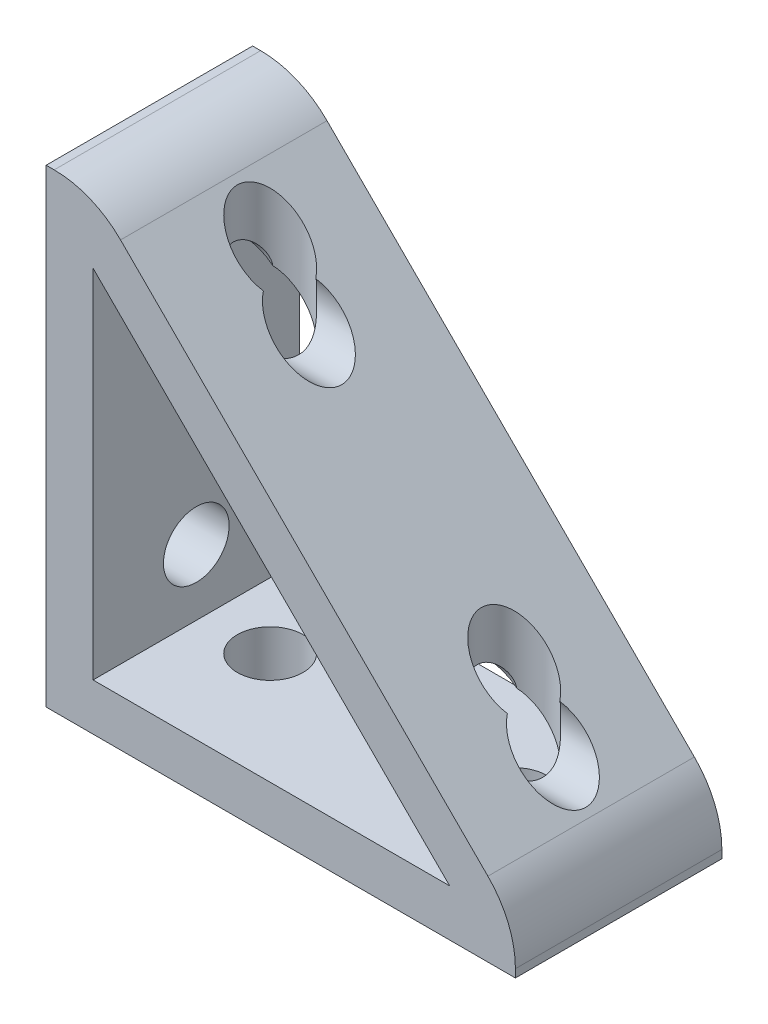
from build123d import *

# Parameters (mm, degrees)
BOSS_EXTRUDE1_DEPTH = 22
FILLET1_R           = 10
FILLET2_R           = 10
SKETCH2_R           = 3.5
CUT_EXTRUDE2_DEPTH  = 50
SKETCH4_R           = 3.5
CUT_EXTRUDE3_DEPTH  = 50


with BuildPart() as part:
    # Sketch1 → Boss-Extrude1 (new body)
    with BuildSketch(Plane.XY):
        Polygon((-28.466334251, 33.673519048), (-28.466334251, -16.326480952), (21.533665749, -16.326480952), (21.533665749, -11.326480952), (-23.466334251, 33.673519048), align=None)
        Polygon((14.533665749, -11.326480952), (-23.466334251, -11.326480952), (-23.466334251, 26.673519048), align=None, mode=Mode.SUBTRACT)
    extrude(amount=BOSS_EXTRUDE1_DEPTH)

    # Fillet1
    fillet1_edges = [part.edges().sort_by_distance(p)[0] for p in [
        (-23.466334251, 33.673519048, 11),
    ]]
    fillet(fillet1_edges, radius=FILLET1_R)

    # Fillet2
    fillet2_edges = [part.edges().sort_by_distance(p)[0] for p in [
        (21.533665749, -11.326480952, 11),
    ]]
    fillet(fillet2_edges, radius=FILLET2_R)

    # Sketch2 → Cut-Extrude2 (cut)
    with BuildSketch(Plane.ZY.offset(28.466334251)):
        with Locations(Location((11, 21.673519048, 0), (0, 0, 270))):
            Circle(SKETCH2_R)
        with Locations(Location((11, -4.326480952, 0), (0, 0, 270))):
            Circle(SKETCH2_R)
    extrude(amount=-CUT_EXTRUDE2_DEPTH, mode=Mode.SUBTRACT)

    # Sketch4 → Cut-Extrude3 (cut)
    with BuildSketch(Plane.XZ.offset(16.326480952)):
        with Locations(Location((-16.466334251, 10.12780984, 0), (0, 0, 270))):
            Circle(SKETCH4_R)
        with Locations(Location((9.533665749, 10.12780984, 0), (0, 0, 270))):
            Circle(SKETCH4_R)
    extrude(amount=-CUT_EXTRUDE3_DEPTH, mode=Mode.SUBTRACT)


solid = part.part
